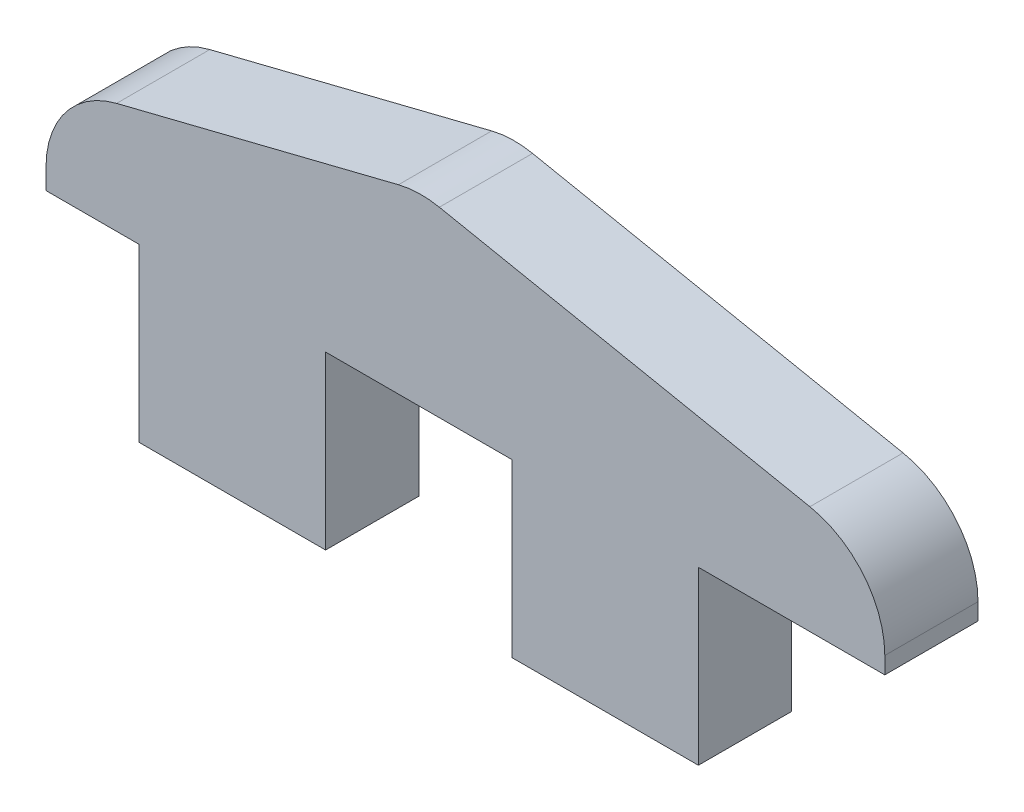
from build123d import *

# Parameters (mm, degrees)
BOSS_EXTRUDE1_DEPTH = 3.175
FILLET1_R           = 3.175


with BuildPart() as part:
    # Sketch1 → Boss-Extrude1 (new body)
    with BuildSketch(Plane.XY):
        Polygon((0, 5.842), (6.35, 5.842), (6.35, 0), (12.7, 0), (12.7, 5.842), (19.05, 5.842), (19.05, 9.017), (3.175, 12.192), (-9.525, 9.017), (-9.525, 5.842), (-6.35, 5.842), (-6.35, 0), (0, 0), align=None)
    extrude(amount=BOSS_EXTRUDE1_DEPTH)

    # Fillet1
    fillet1_edges = [part.edges().sort_by_distance(p)[0] for p in [
        (-9.525, 9.017, 1.5875),
        (3.175, 12.192, 1.5875),
        (19.05, 9.017, 1.5875),
    ]]
    fillet(fillet1_edges, radius=FILLET1_R)


solid = part.part
